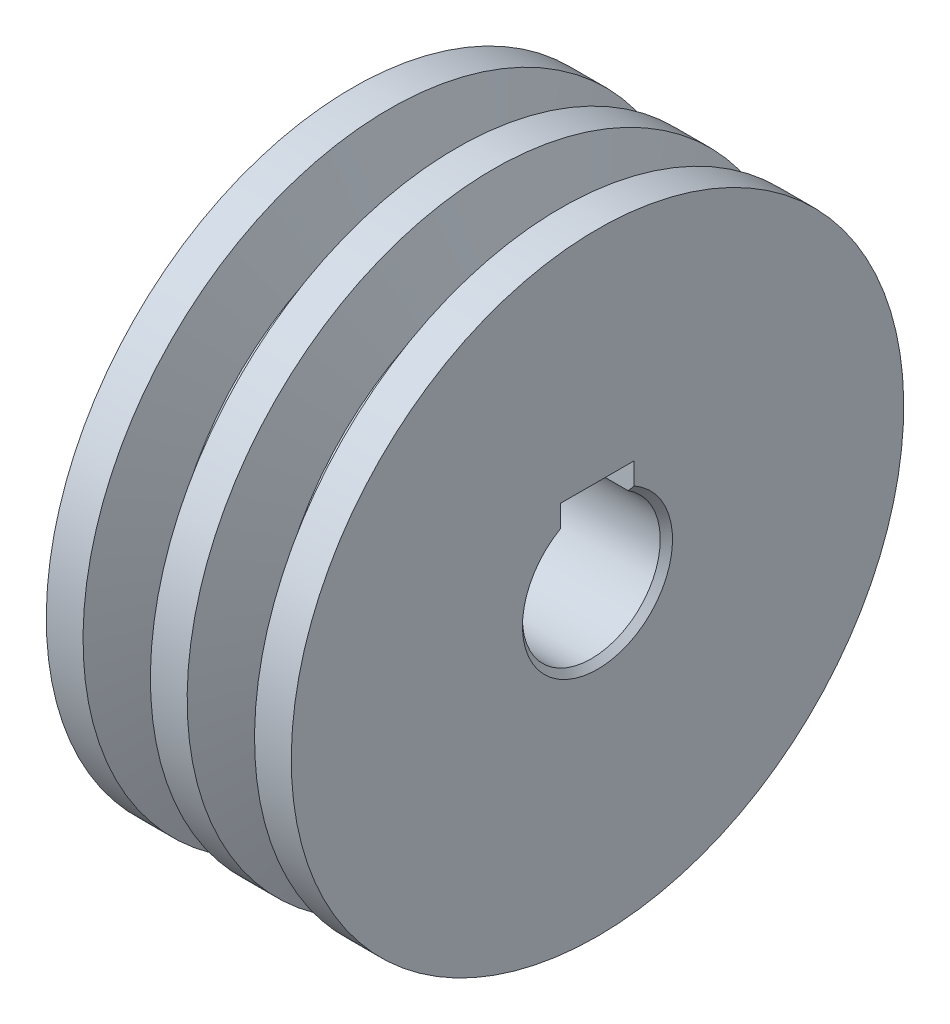
from build123d import *

# Parameters (mm, degrees)
SKETCH2_R           = 25
BOSS_EXTRUDE1_DEPTH = 10
SKETCH4_R           = 11.25
SKETCH4_W           = 12
SKETCH4_H           = 6
CUT_EXTRUDE1_DEPTH  = 87.602540378
FILLET1_R           = 0.2
CHAMFER1_SIZE       = 1
CHAMFER2_SIZE       = 1


with BuildPart() as part:
    # Sketch1 → Revolve12 (revolve)
    with BuildSketch(Plane.XY, mode=Mode.PRIVATE) as revolve12_sk:
        Polygon((3, 50), (-3, 50), (-6.639702343, 40), (-10.360297657, 40), (-14, 50), (-20, 50), (-20, 0), (20, 0), (20, 50), (14, 50), (10.360297657, 40), (6.639702343, 40), align=None)
    revolve(revolve12_sk.sketch.rotate(Axis((-20, 0, 0), (1, 0, 0)), 180), axis=Axis((-20, 0, 0), (1, 0, 0)))

    # Sketch2 → Boss-Extrude1 (add)
    with BuildSketch(Plane.ZY.offset(20)):
        with Locations(Location((0, 0, 0), (0, 0, 90))):
            Circle(SKETCH2_R)
    extrude(amount=BOSS_EXTRUDE1_DEPTH)

    # Sketch4 → Cut-Extrude1 (cut, through all)
    with BuildSketch(Plane.ZY.offset(30)):
        Circle(SKETCH4_R)
        with Locations((0, 11.25)):
            Rectangle(SKETCH4_W, SKETCH4_H)
    extrude(amount=-CUT_EXTRUDE1_DEPTH, mode=Mode.SUBTRACT)

    # Fillet1
    fillet1_edges = [part.edges().sort_by_distance(p)[0] for p in [
        (-20, -25, 0),
    ]]
    fillet(fillet1_edges, radius=FILLET1_R)

    # Chamfer1
    chamfer1_edges = [part.edges().sort_by_distance(p)[0] for p in [
        (20, -11.25, 0),
    ]]
    chamfer(chamfer1_edges, length=CHAMFER1_SIZE)

    # Chamfer2
    chamfer2_edges = [part.edges().sort_by_distance(p)[0] for p in [
        (-30, -11.25, 0),
    ]]
    chamfer(chamfer2_edges, length=CHAMFER2_SIZE)


solid = part.part
